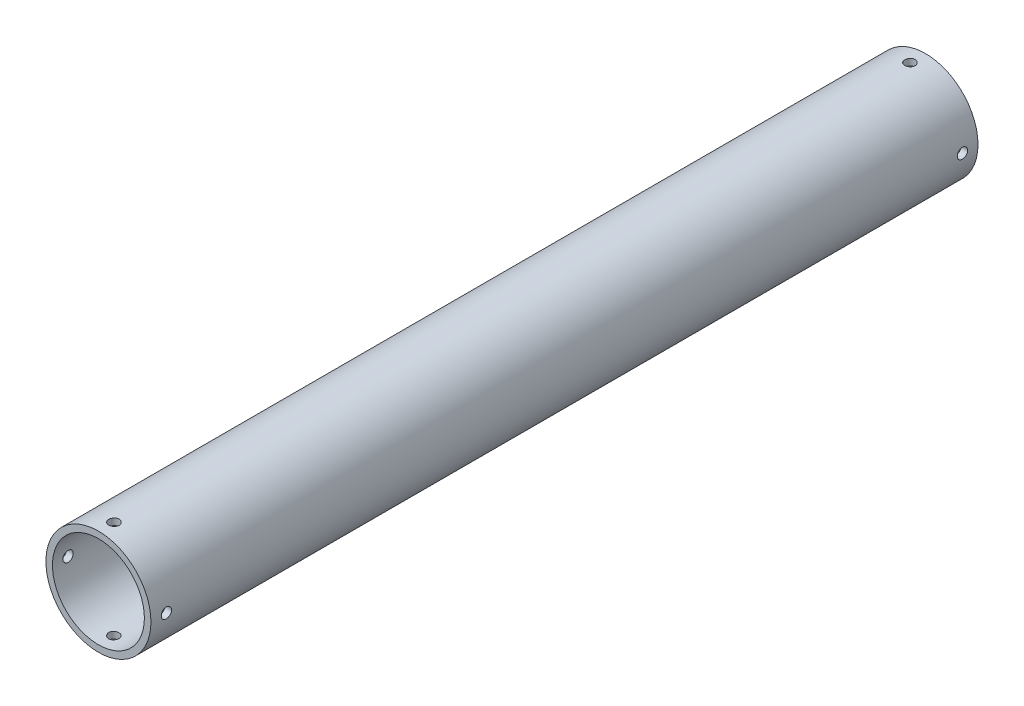
from build123d import *

# Parameters (mm, degrees)
ESBO_O1_R                = 25.4
ESBO_O1_R_2              = 22.23
RESSALTO_EXTRUS_O1_DEPTH = 400
CORTE_EXTRUS_O1_REACH    = 406.012
ESBO_O3_R                = 2.5
PADR_OCIRCULAR1_COUNT    = 4
CORTE_EXTRUS_O2_REACH    = 406.012
ESBO_O4_R                = 2.5
PADR_OCIRCULAR2_COUNT    = 4


with BuildPart() as part:
    # Esboço1 → Ressalto-extrusão1 (new body)
    with BuildSketch(Plane.XY):
        Circle(ESBO_O1_R)
        Circle(ESBO_O1_R_2, mode=Mode.SUBTRACT)
    extrude(amount=RESSALTO_EXTRUS_O1_DEPTH)

    # Esboço3 → Corte-extrusão1 (cut, up to next)
    with BuildSketch(Plane(origin=(0, 25.4, 0), x_dir=(1, 0, 0), z_dir=(0, 1, 0)), mode=Mode.PRIVATE) as corte_extrus_o1_sk1:
        with Locations((0, -392.5)):
            Circle(ESBO_O3_R)
    corte_extrus_o1_tool1 = extrude(corte_extrus_o1_sk1.sketch, amount=-CORTE_EXTRUS_O1_REACH, mode=Mode.PRIVATE) & part.part
    corte_extrus_o1 = corte_extrus_o1_tool1.solids().sort_by_distance((0, 25.4, 392.5))[0]
    add(corte_extrus_o1, mode=Mode.SUBTRACT)

    # PadrãoCircular1: Corte-extrusão1 ×4 about axis
    padr_ocircular1_axis = Axis((0, 0, 400), (0, 0, 1))
    for i in range(1, PADR_OCIRCULAR1_COUNT):
        add(corte_extrus_o1.rotate(padr_ocircular1_axis, i * 360 / PADR_OCIRCULAR1_COUNT), mode=Mode.SUBTRACT)

    # Esboço4 → Corte-extrusão2 (cut, up to next)
    with BuildSketch(Plane(origin=(0, 25.4, 0), x_dir=(1, 0, 0), z_dir=(0, 1, 0)), mode=Mode.PRIVATE) as corte_extrus_o2_sk1:
        with Locations((-0.017770346, -7.5)):
            Circle(ESBO_O4_R)
    corte_extrus_o2_tool1 = extrude(corte_extrus_o2_sk1.sketch, amount=-CORTE_EXTRUS_O2_REACH, mode=Mode.PRIVATE) & part.part
    corte_extrus_o2 = corte_extrus_o2_tool1.solids().sort_by_distance((-0.01777, 25.4, 7.5))[0]
    add(corte_extrus_o2, mode=Mode.SUBTRACT)

    # PadrãoCircular2: Corte-extrusão2 ×4 about axis
    padr_ocircular2_axis = Axis((0, 0, 0), (0, 0, 1))
    for i in range(1, PADR_OCIRCULAR2_COUNT):
        add(corte_extrus_o2.rotate(padr_ocircular2_axis, i * 360 / PADR_OCIRCULAR2_COUNT), mode=Mode.SUBTRACT)


solid = part.part
